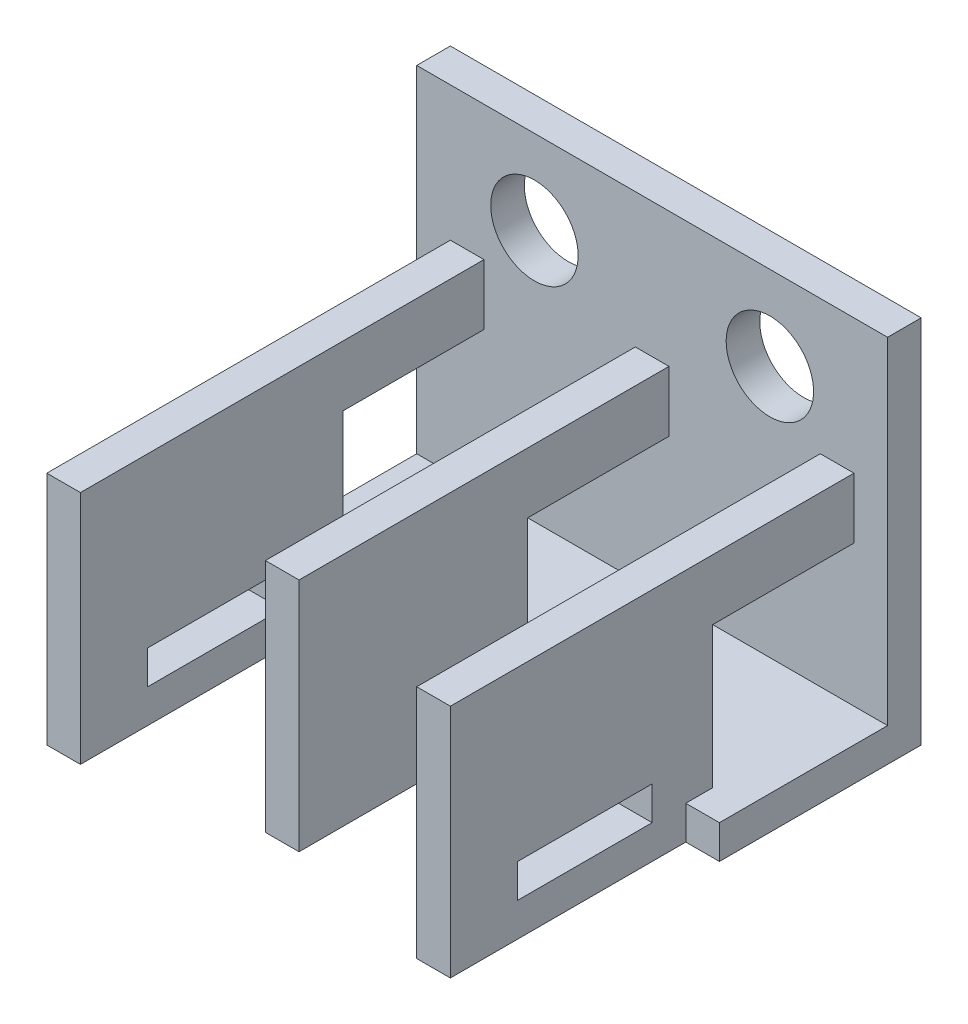
from build123d import *

# Parameters (mm, degrees)
SKETCH1_W           = 70
SKETCH1_H           = 50
BOSS_EXTRUDE1_DEPTH = 5
SKETCH2_W           = 5
SKETCH2_H           = 30
BOSS_EXTRUDE2_DEPTH = 25
SKETCH3_W           = 21
SKETCH3_H           = 21
CUT_EXTRUDE1_DEPTH  = 5
SKETCH4_W           = 21
SKETCH4_H           = 21
CUT_EXTRUDE2_DEPTH  = 5
SKETCH5_W           = 21
SKETCH5_H           = 21
CUT_EXTRUDE3_DEPTH  = 5
SKETCH6_W           = 70
SKETCH6_H           = 30
BOSS_EXTRUDE3_DEPTH = 5
SKETCH7_W           = 5
SKETCH7_H           = 35
BOSS_EXTRUDE4_DEPTH = 35
SKETCH8_R           = 6.5
CUT_EXTRUDE4_DEPTH  = 5
SKETCH9_W           = 5
SKETCH9_H           = 35
CUT_EXTRUDE5_DEPTH  = 5
SKETCH10_W          = 20
SKETCH10_H          = 5
CUT_EXTRUDE6_DEPTH  = 5
SKETCH11_W          = 20
SKETCH11_H          = 5
CUT_EXTRUDE7_DEPTH  = 5


with BuildPart() as part:
    # Sketch1 → Boss-Extrude1 (new body)
    with BuildSketch(Plane.XY):
        with Locations((-35, 25)):
            Rectangle(SKETCH1_W, SKETCH1_H)
    extrude(amount=BOSS_EXTRUDE1_DEPTH)

    # Sketch2 → Boss-Extrude2 (add)
    with BuildSketch(Plane.XY.offset(5)):
        with Locations((-62.5, 15)):
            Rectangle(SKETCH2_W, SKETCH2_H)
        with Locations((-35, 15)):
            Rectangle(SKETCH2_W, SKETCH2_H)
        with Locations((-7.5, 15)):
            Rectangle(SKETCH2_W, SKETCH2_H)
    extrude(amount=BOSS_EXTRUDE2_DEPTH)

    # Sketch3 → Cut-Extrude1 (cut)
    with BuildSketch(Plane(origin=(-5, 0, 0), x_dir=(0, 0, -1), z_dir=(1, 0, 0))):
        with Locations((-15.5, 10.5)):
            Rectangle(SKETCH3_W, SKETCH3_H)
    extrude(amount=-CUT_EXTRUDE1_DEPTH, mode=Mode.SUBTRACT)

    # Sketch4 → Cut-Extrude2 (cut)
    with BuildSketch(Plane(origin=(-32.5, 0, 0), x_dir=(0, 0, -1), z_dir=(1, 0, 0))):
        with Locations((-15.5, 10.5)):
            Rectangle(SKETCH4_W, SKETCH4_H)
    extrude(amount=-CUT_EXTRUDE2_DEPTH, mode=Mode.SUBTRACT)

    # Sketch5 → Cut-Extrude3 (cut)
    with BuildSketch(Plane(origin=(-60, 0, 0), x_dir=(0, 0, -1), z_dir=(1, 0, 0))):
        with Locations((-15.5, 10.5)):
            Rectangle(SKETCH5_W, SKETCH5_H)
    extrude(amount=-CUT_EXTRUDE3_DEPTH, mode=Mode.SUBTRACT)

    # Sketch6 → Boss-Extrude3 (add)
    with BuildSketch(Plane.XZ):
        with Locations((-35, 15)):
            Rectangle(SKETCH6_W, SKETCH6_H)
    extrude(amount=BOSS_EXTRUDE3_DEPTH)

    # Sketch7 → Boss-Extrude4 (add)
    with BuildSketch(Plane.XY.offset(30)):
        with Locations((-35, 12.5)):
            Rectangle(SKETCH7_W, SKETCH7_H)
        with Locations((-7.5, 12.5)):
            Rectangle(SKETCH7_W, SKETCH7_H)
        with Locations((-62.5, 12.5)):
            Rectangle(SKETCH7_W, SKETCH7_H)
    extrude(amount=BOSS_EXTRUDE4_DEPTH)

    # Sketch8 → Cut-Extrude4 (cut)
    with BuildSketch(Plane(origin=(0, 0, 0), x_dir=(-1, 0, 0), z_dir=(0, 0, -1))):
        with Locations((17.5, 37.5)):
            Circle(SKETCH8_R)
        with Locations((52.5, 37.5)):
            Circle(SKETCH8_R)
    extrude(amount=-CUT_EXTRUDE4_DEPTH, mode=Mode.SUBTRACT)

    # Sketch9 → Cut-Extrude5 (cut)
    with BuildSketch(Plane.XY.offset(65)):
        with Locations((-35, 12.5)):
            Rectangle(SKETCH9_W, SKETCH9_H)
    extrude(amount=-CUT_EXTRUDE5_DEPTH, mode=Mode.SUBTRACT)

    # Sketch10 → Cut-Extrude6 (cut)
    with BuildSketch(Plane(origin=(-5, 0, 0), x_dir=(0, 0, -1), z_dir=(1, 0, 0))):
        with Locations((-45, 2.5)):
            Rectangle(SKETCH10_W, SKETCH10_H)
    extrude(amount=-CUT_EXTRUDE6_DEPTH, mode=Mode.SUBTRACT)

    # Sketch11 → Cut-Extrude7 (cut)
    with BuildSketch(Plane.ZY.offset(65)):
        with Locations((45, 2.5)):
            Rectangle(SKETCH11_W, SKETCH11_H)
    extrude(amount=-CUT_EXTRUDE7_DEPTH, mode=Mode.SUBTRACT)


solid = part.part
